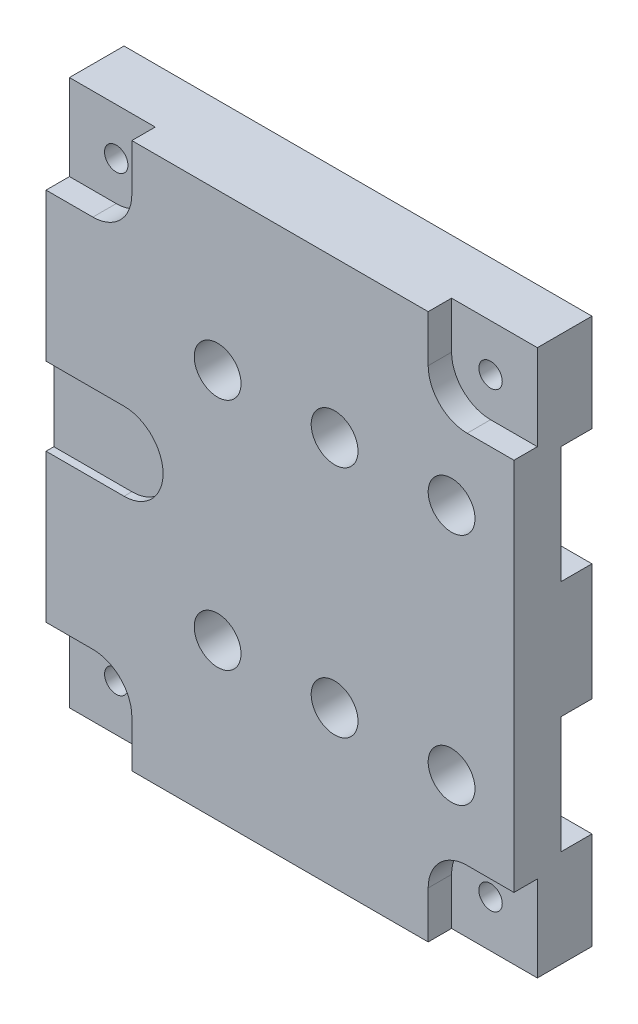
from build123d import *

# Parameters (mm, degrees)
SKETCH_1_W          = 60
SKETCH_1_H          = 70
EXTRUDE_1_DEPTH     = 10
SKETCH_2_R          = 3
CUT_EXTRUDE_1_DEPTH = 48.16990566
CUT_EXTRUDE_START   = -4
SKETCH_3_R          = 7.5
SKETCH_3_R_2        = 3
CUT_EXTRUDE_2_DEPTH = 4
SKETCH_4_R          = 5
CUT_EXTRUDE_3_DEPTH = 1
EXTRUDE_2_DEPTH     = 12.5
SKETCH_7_R          = 9.5
CUT_EXTRUDE_4_DEPTH = 12.5
CUT_EXTRUDE_5_DEPTH = 56
SKETCH_9_R          = 1.5
CUT_EXTRUDE_6_DEPTH = 48.16990566
CUT_EXTRUDE_START_2 = -3
SKETCH_10_R         = 1.5
CUT_EXTRUDE_7_DEPTH = 3


with BuildPart() as part:
    # 草图1 → 凸台-拉伸1 (new body)
    with BuildSketch(Plane.XY):
        Rectangle(SKETCH_1_W, SKETCH_1_H)
    extrude(amount=EXTRUDE_1_DEPTH)

    # 草图2 → 切除-拉伸1 (cut, through all)
    with BuildSketch(Plane.XY.offset(10)):
        with Locations((-8, 15)):
            Circle(SKETCH_2_R)
        with Locations((7, 15)):
            Circle(SKETCH_2_R)
        with Locations((-8, -15)):
            Circle(SKETCH_2_R)
        with Locations((7, -15)):
            Circle(SKETCH_2_R)
        with Locations((22, 15)):
            Circle(SKETCH_2_R)
        with Locations((22, -15)):
            Circle(SKETCH_2_R)
    extrude(amount=-CUT_EXTRUDE_1_DEPTH, mode=Mode.SUBTRACT)

    # 草图3 → 切除-拉伸2 (cut)
    # profile 1 of 2: a face of its own
    with BuildSketch(Plane(origin=(0, 0, 0), x_dir=(-1, 0, 0), z_dir=(0, 0, -1)).offset(CUT_EXTRUDE_START)):
        with Locations((8, 15)):
            Circle(SKETCH_3_R)
        with Locations(Location((8, 15, 0), (0, 0, 180))):
            Circle(SKETCH_3_R_2, mode=Mode.SUBTRACT)
    # profile 2 of 2: a face of its own
    with BuildSketch(Plane(origin=(0, 0, 0), x_dir=(-1, 0, 0), z_dir=(0, 0, -1)).offset(CUT_EXTRUDE_START)):
        with BuildLine():
            ThreePointArc((8, 7.5), (0.5, 15), (8, 22.5))
            Line((8, 22.5), (-30, 22.5))
            Line((-30, 22.5), (-30, 7.5))
            Line((-30, 7.5), (8, 7.5))
        make_face()
        with Locations(Location((-7, 15, 0), (0, 0, 180))):
            Circle(SKETCH_3_R_2, mode=Mode.SUBTRACT)
    cut_extrude_2 = extrude(amount=CUT_EXTRUDE_2_DEPTH, mode=Mode.SUBTRACT)

    # 镜向1: 切除-拉伸2 across plane
    add(cut_extrude_2.mirror(Plane.ZX), mode=Mode.SUBTRACT)

    # 草图4 → 切除-拉伸3 (cut)
    with BuildSketch(Plane.XY.offset(10)):
        with Locations((-20, 0)):
            Circle(SKETCH_4_R)
        with BuildLine():
            ThreePointArc((-20, -5), (-25, 0), (-20, 5))
            Line((-20, 5), (-30, 5))
            Line((-30, 5), (-30, -5))
            Line((-30, -5), (-20, -5))
        make_face()
    extrude(amount=-CUT_EXTRUDE_3_DEPTH, mode=Mode.SUBTRACT)

    # 草图6 → 凸台-拉伸2 (add)
    with BuildSketch(Plane(origin=(0, 35, 0), x_dir=(1, 0, 0), z_dir=(0, 1, 0))):
        with BuildLine():
            ThreePointArc((30, 0), (20.807611845, 3.807611845), (17, 13))
            ThreePointArc((17, 13), (0, 30), (-17, 13))
            ThreePointArc((-17, 13), (-20.807611845, 3.807611845), (-30, 0))
            Line((-30, 0), (30, 0))
        make_face()
    extrude_2 = extrude(amount=-EXTRUDE_2_DEPTH)

    # 草图7 → 切除-拉伸4 (cut)
    with BuildSketch(Plane(origin=(0, 35, 0), x_dir=(1, 0, 0), z_dir=(0, 1, 0))):
        with Locations(Location((0, 13, 0), (0, 0, 270))):
            Circle(SKETCH_7_R)
    cut_extrude_4 = extrude(amount=-CUT_EXTRUDE_4_DEPTH, mode=Mode.SUBTRACT)

    # 镜向2: 凸台-拉伸2, 切除-拉伸4 across plane
    add(extrude_2.mirror(Plane.ZX))
    add(cut_extrude_4.mirror(Plane.ZX), mode=Mode.SUBTRACT)

    # 草图8 → 切除-拉伸5 (cut, through all)
    with BuildSketch(Plane(origin=(0, 0, 0), x_dir=(-1, 0, 0), z_dir=(0, 0, -1))):
        with BuildLine():
            Line((30, -5), (20, -5))
            ThreePointArc((20, -5), (15, 0), (20, 5))
            Line((20, 5), (30, 5))
            Line((30, 5), (30, 35))
            Line((30, 35), (-30, 35))
            Line((-30, 35), (-30, -35))
            Line((-30, -35), (30, -35))
            Line((30, -35), (30, -5))
        make_face()
    extrude(amount=CUT_EXTRUDE_5_DEPTH, mode=Mode.SUBTRACT)

    # 草图9 → 切除-拉伸6 (cut, through all)
    with BuildSketch(Plane(origin=(0, 0, 0), x_dir=(-1, 0, 0), z_dir=(0, 0, -1))):
        with Locations((-24, -29)):
            Circle(SKETCH_9_R)
        with Locations((24, -29)):
            Circle(SKETCH_9_R)
    cut_extrude_6 = extrude(amount=-CUT_EXTRUDE_6_DEPTH, mode=Mode.SUBTRACT)

    # 草图10 → 切除-拉伸7 (cut)
    # profile 1 of 2: a face of its own
    with BuildSketch(Plane.XY.offset(10).offset(CUT_EXTRUDE_START_2)):
        with BuildLine():
            Line((-24, -24), (-30, -24))
            Line((-30, -24), (-30, -35))
            Line((-30, -35), (-19, -35))
            Line((-19, -35), (-19, -29))
            ThreePointArc((-19, -29), (-20.464466094, -25.464466094), (-24, -24))
        make_face()
        with Locations(Location((-24, -29, 0), (0, 0, 180))):
            Circle(SKETCH_10_R, mode=Mode.SUBTRACT)
    # profile 2 of 2: a face of its own
    with BuildSketch(Plane.XY.offset(10).offset(CUT_EXTRUDE_START_2)):
        with BuildLine():
            Line((19, -29), (19, -35))
            Line((19, -35), (30, -35))
            Line((30, -35), (30, -24))
            Line((30, -24), (24, -24))
            ThreePointArc((24, -24), (20.464466094, -25.464466094), (19, -29))
        make_face()
        with Locations(Location((24, -29, 0), (0, 0, 180))):
            Circle(SKETCH_10_R, mode=Mode.SUBTRACT)
    cut_extrude_7 = extrude(amount=CUT_EXTRUDE_7_DEPTH, mode=Mode.SUBTRACT)

    # 镜向3: 切除-拉伸6, 切除-拉伸7 across plane
    add(cut_extrude_6.mirror(Plane.ZX), mode=Mode.SUBTRACT)
    add(cut_extrude_7.mirror(Plane.ZX), mode=Mode.SUBTRACT)


solid = part.part
